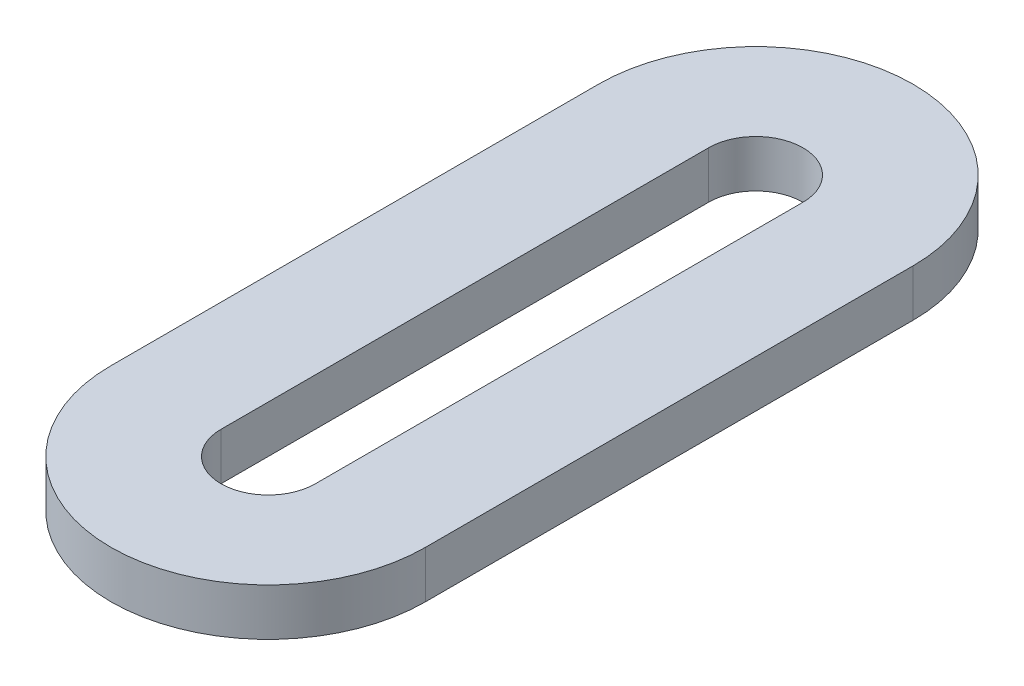
from build123d import *

# Parameters (mm, degrees)
BOSS_EXTRUDE1_DEPTH = 3


with BuildPart() as part:
    # Sketch1 → Boss-Extrude1 (new body)
    with BuildSketch(Plane(origin=(0, 0, 0), x_dir=(1, 0, 0), z_dir=(0, 1, 0))):
        with BuildLine():
            Line((10, 31), (10, 0))
            ThreePointArc((10, 0), (0, -10), (-10, 0))
            Line((-10, 0), (-10, 31))
            ThreePointArc((-10, 31), (0, 41), (10, 31))
        make_face()
        with BuildLine():
            Line((-3, 0), (-3, 31))
            ThreePointArc((-3, 31), (0, 34), (3, 31))
            Line((3, 31), (3, 0))
            ThreePointArc((3, 0), (0, -3), (-3, 0))
        make_face(mode=Mode.SUBTRACT)
    extrude(amount=BOSS_EXTRUDE1_DEPTH)


solid = part.part
